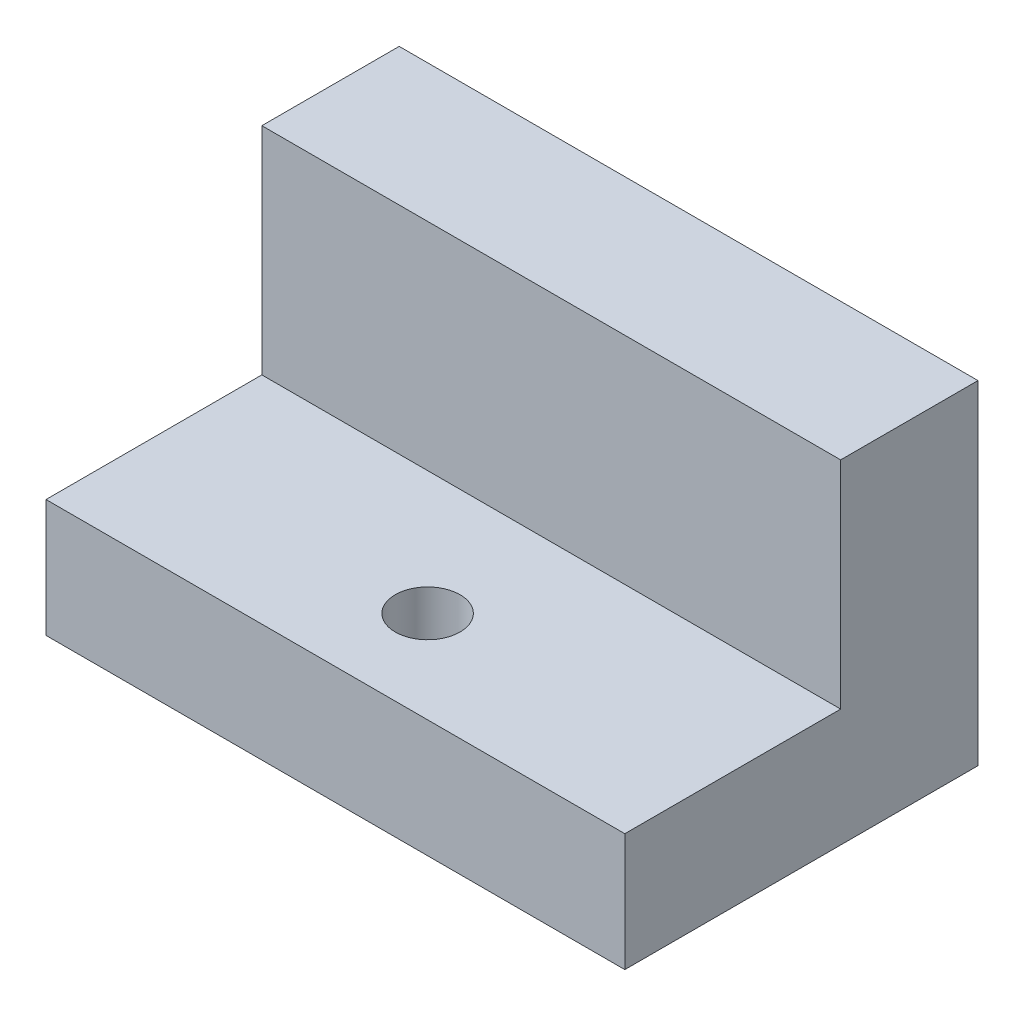
from build123d import *

# Parameters (mm, degrees)
SKETCH1_W           = 29.5
SKETCH1_H           = 10
SKETCH1_H_2         = 8
SKETCH1_R           = 1.65
BOSS_EXTRUDE1_DEPTH = 6
SKETCH3_W           = 29.5
SKETCH3_H           = 7
BOSS_EXTRUDE3_DEPTH = 11


with BuildPart() as part:
    # Sketch1 → Boss-Extrude1 (new body)
    # profile 1 of 2: a face of its own
    with BuildSketch(Plane(origin=(0, 0, 0), x_dir=(1, 0, 0), z_dir=(0, 1, 0))):
        with Locations((0, 9)):
            Rectangle(SKETCH1_W, SKETCH1_H)
    # profile 2 of 2: a face of its own
    with BuildSketch(Plane(origin=(0, 0, 0), x_dir=(1, 0, 0), z_dir=(0, 1, 0))):
        Rectangle(SKETCH1_W, SKETCH1_H_2)
        with Locations(Location((0, 0.7, 0), (0, 0, 270))):
            Circle(SKETCH1_R, mode=Mode.SUBTRACT)
    extrude(amount=BOSS_EXTRUDE1_DEPTH)

    # Sketch3 → Boss-Extrude3 (add)
    with BuildSketch(Plane(origin=(0, 6, 0), x_dir=(1, 0, 0), z_dir=(0, 1, 0))):
        with Locations((0, 10.5)):
            Rectangle(SKETCH3_W, SKETCH3_H)
    extrude(amount=BOSS_EXTRUDE3_DEPTH)


solid = part.part
